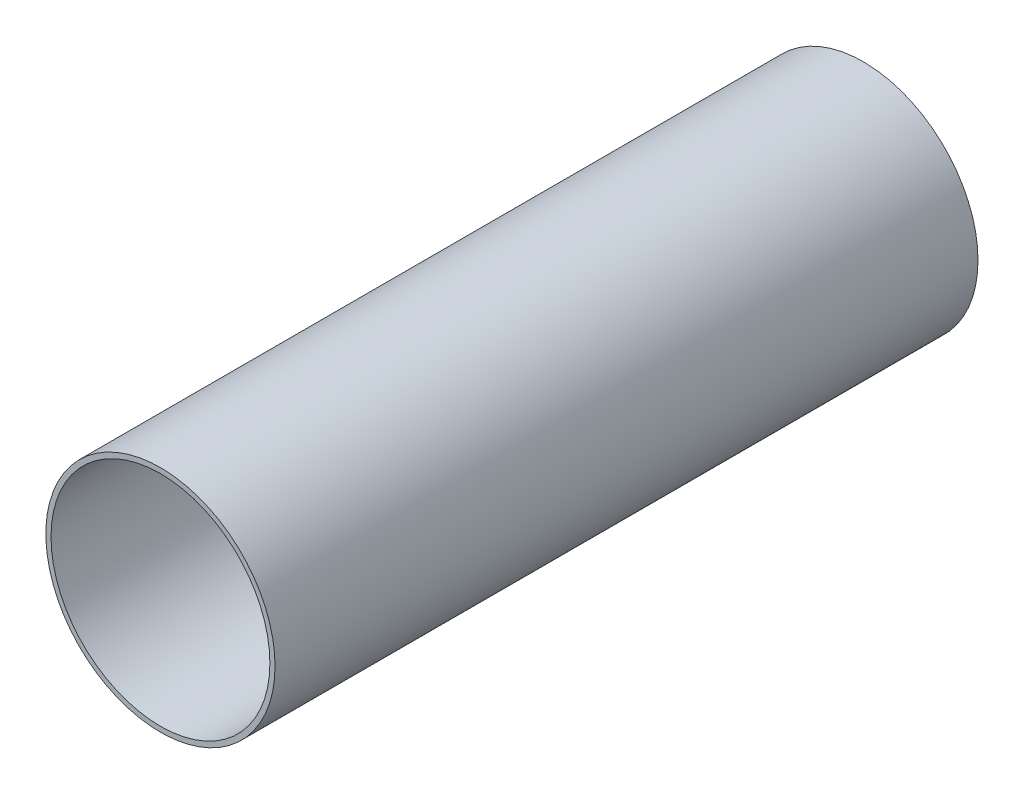
from build123d import *

# Parameters (mm, degrees)
SKETCH1_R           = 26.543
SKETCH1_R_2         = 25.3492
BOSS_EXTRUDE1_DEPTH = 81.407


with BuildPart() as part:
    # Sketch1 → Boss-Extrude1 (new, symmetric)
    with BuildSketch(Plane.XY):
        Circle(SKETCH1_R)
        Circle(SKETCH1_R_2, mode=Mode.SUBTRACT)
    extrude(amount=BOSS_EXTRUDE1_DEPTH, both=True)


solid = part.part
